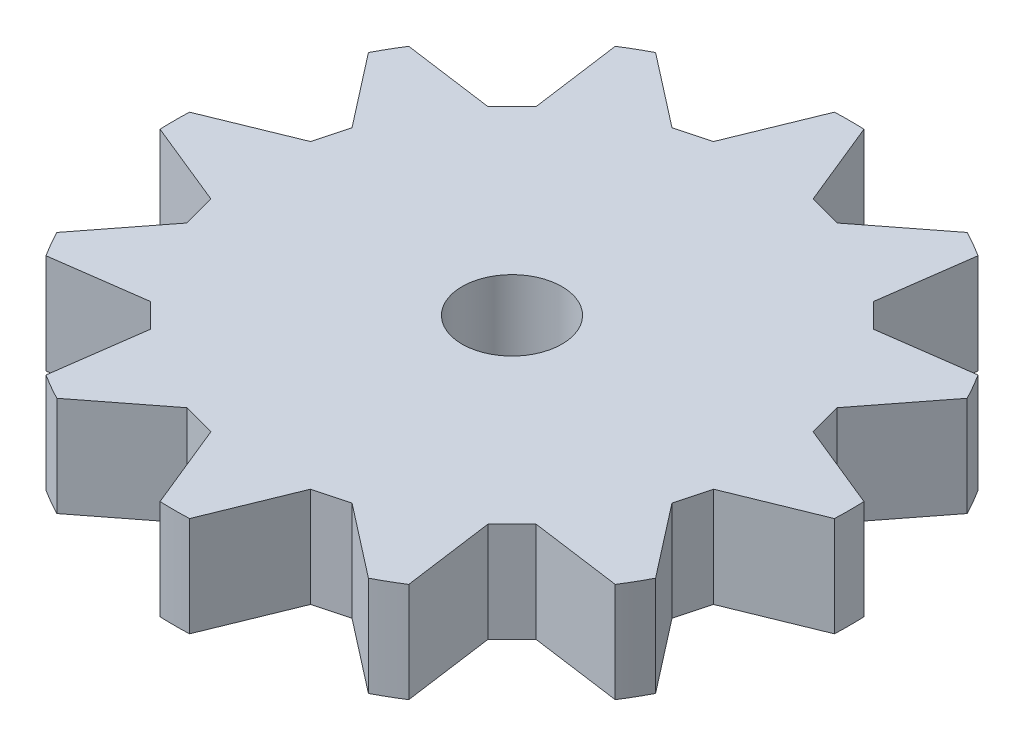
from build123d import *

# Parameters (mm, degrees)
SKETCH1_R           = 15
SKETCH1_R_2         = 2.5
BOSS_EXTRUDE1_DEPTH = 5
BOSS_EXTRUDE2_START = -5
SKETCH2_R           = 17
SKETCH2_R_2         = 15
BOSS_EXTRUDE2_DEPTH = 5
SKETCH3_R           = 18
CUT_EXTRUDE1_DEPTH  = 5
SKETCH4_R           = 18.354217927
CUT_EXTRUDE2_DEPTH  = 5


with BuildPart() as part:
    # Sketch1 → Boss-Extrude1 (new body)
    with BuildSketch(Plane(origin=(0, 0, 0), x_dir=(1, 0, 0), z_dir=(0, 1, 0))):
        with Locations(Location((0, 0, 0), (0, 0, 270))):
            Circle(SKETCH1_R)
        with Locations(Location((0, 0, 0), (0, 0, 270))):
            Circle(SKETCH1_R_2, mode=Mode.SUBTRACT)
    extrude(amount=BOSS_EXTRUDE1_DEPTH)

    # Sketch2 → Boss-Extrude2 (add)
    with BuildSketch(Plane(origin=(0, 5, 0), x_dir=(1, 0, 0), z_dir=(0, 1, 0)).offset(BOSS_EXTRUDE2_START)):
        with Locations(Location((0, 0, 0), (0, 0, 270))):
            Circle(SKETCH2_R)
        Circle(SKETCH2_R_2, mode=Mode.SUBTRACT)
    extrude(amount=BOSS_EXTRUDE2_DEPTH)

    # Sketch3 → Cut-Extrude1 (cut)
    with BuildSketch(Plane(origin=(0, 5, 0), x_dir=(1, 0, 0), z_dir=(0, 1, 0))):
        Circle(SKETCH3_R)
        Polygon((0.800081407, 17), (-0.800081407, 17), (-2.565946388, 12.667519465), (-3.338765682, 12.460443159), (-4.111584976, 12.253366853), (-7.807109176, 15.122472568), (-9.192890824, 14.322391161), (-8.555934489, 9.687420466), (-9.121677477, 9.121677477), (-9.687420466, 8.555934489), (-14.322391161, 9.192890824), (-15.122472568, 7.807109176), (-12.253366853, 4.111584976), (-12.460443159, 3.338765682), (-12.667519465, 2.565946388), (-17, 0.800081407), (-17, -0.800081407), (-12.667519465, -2.565946388), (-12.460443159, -3.338765682), (-12.253366853, -4.111584976), (-15.122472568, -7.807109176), (-14.322391161, -9.192890824), (-9.687420466, -8.555934489), (-9.121677477, -9.121677477), (-8.555934489, -9.687420466), (-9.192890824, -14.322391161), (-7.807109176, -15.122472568), (-4.111584976, -12.253366853), (-3.338765682, -12.460443159), (-2.565946388, -12.667519465), (-0.800081407, -17), (0.800081407, -17), (2.565946388, -12.667519465), (3.338765682, -12.460443159), (4.111584976, -12.253366853), (7.807109176, -15.122472568), (9.192890824, -14.322391161), (8.555934489, -9.687420466), (9.121677477, -9.121677477), (9.687420466, -8.555934489), (14.322391161, -9.192890824), (15.122472568, -7.807109176), (12.253366853, -4.111584976), (12.460443159, -3.338765682), (12.667519465, -2.565946388), (17, -0.800081407), (17, 0.800081407), (12.667519465, 2.565946388), (12.460443159, 3.338765682), (12.253366853, 4.111584976), (15.122472568, 7.807109176), (14.322391161, 9.192890824), (9.687420466, 8.555934489), (9.121677477, 9.121677477), (8.555934489, 9.687420466), (9.192890824, 14.322391161), (7.807109176, 15.122472568), (4.111584976, 12.253366853), (3.338765682, 12.460443159), (2.565946388, 12.667519465), align=None, mode=Mode.SUBTRACT)
    extrude(amount=-CUT_EXTRUDE1_DEPTH, mode=Mode.SUBTRACT)

    # Sketch4 → Cut-Extrude2 (cut)
    with BuildSketch(Plane(origin=(0, 5, 0), x_dir=(1, 0, 0), z_dir=(0, 1, 0))):
        Circle(SKETCH4_R)
        with BuildLine():
            Line((2.492089445, 12.583781755), (4.133678109, 12.143919398))
            Line((4.133678109, 12.143919398), (7.801525521, 14.991537598))
            ThreePointArc((7.801525521, 14.991537598), (8.45, 14.635829324), (9.082289641, 14.252088088))
            Line((9.082289641, 14.252088088), (8.450103646, 9.651829953))
            Line((8.450103646, 9.651829953), (9.651829953, 8.450103646))
            Line((9.651829953, 8.450103646), (14.252088088, 9.082289641))
            ThreePointArc((14.252088088, 9.082289641), (14.635829324, 8.45), (14.991537598, 7.801525521))
            Line((14.991537598, 7.801525521), (12.143919398, 4.133678109))
            Line((12.143919398, 4.133678109), (12.583781755, 2.492089445))
            Line((12.583781755, 2.492089445), (16.883815162, 0.739449509))
            ThreePointArc((16.883815162, 0.739449509), (16.9, 0), (16.883815162, -0.739449509))
            Line((16.883815162, -0.739449509), (12.583781755, -2.492089445))
            Line((12.583781755, -2.492089445), (12.143919398, -4.133678109))
            Line((12.143919398, -4.133678109), (14.991537598, -7.801525521))
            ThreePointArc((14.991537598, -7.801525521), (14.635829324, -8.45), (14.252088088, -9.082289641))
            Line((14.252088088, -9.082289641), (9.651829953, -8.450103646))
            Line((9.651829953, -8.450103646), (8.450103646, -9.651829953))
            Line((8.450103646, -9.651829953), (9.082289641, -14.252088088))
            ThreePointArc((9.082289641, -14.252088088), (8.45, -14.635829324), (7.801525521, -14.991537598))
            Line((7.801525521, -14.991537598), (4.133678109, -12.143919398))
            Line((4.133678109, -12.143919398), (2.492089445, -12.583781755))
            Line((2.492089445, -12.583781755), (0.739449509, -16.883815162))
            ThreePointArc((0.739449509, -16.883815162), (0, -16.9), (-0.739449509, -16.883815162))
            Line((-0.739449509, -16.883815162), (-2.492089445, -12.583781755))
            Line((-2.492089445, -12.583781755), (-4.133678109, -12.143919398))
            Line((-4.133678109, -12.143919398), (-7.801525521, -14.991537598))
            ThreePointArc((-7.801525521, -14.991537598), (-8.45, -14.635829324), (-9.082289641, -14.252088088))
            Line((-9.082289641, -14.252088088), (-8.450103646, -9.651829953))
            Line((-8.450103646, -9.651829953), (-9.651829953, -8.450103646))
            Line((-9.651829953, -8.450103646), (-14.252088088, -9.082289641))
            ThreePointArc((-14.252088088, -9.082289641), (-14.635829324, -8.45), (-14.991537598, -7.801525521))
            Line((-14.991537598, -7.801525521), (-12.143919398, -4.133678109))
            Line((-12.143919398, -4.133678109), (-12.583781755, -2.492089445))
            Line((-12.583781755, -2.492089445), (-16.883815162, -0.739449509))
            ThreePointArc((-16.883815162, -0.739449509), (-16.9, 0), (-16.883815162, 0.739449509))
            Line((-16.883815162, 0.739449509), (-12.583781755, 2.492089445))
            Line((-12.583781755, 2.492089445), (-12.143919398, 4.133678109))
            Line((-12.143919398, 4.133678109), (-14.991537598, 7.801525521))
            ThreePointArc((-14.991537598, 7.801525521), (-14.635829324, 8.45), (-14.252088088, 9.082289641))
            Line((-14.252088088, 9.082289641), (-9.651829953, 8.450103646))
            Line((-9.651829953, 8.450103646), (-8.450103646, 9.651829953))
            Line((-8.450103646, 9.651829953), (-9.082289641, 14.252088088))
            ThreePointArc((-9.082289641, 14.252088088), (-8.45, 14.635829324), (-7.801525521, 14.991537598))
            Line((-7.801525521, 14.991537598), (-4.133678109, 12.143919398))
            Line((-4.133678109, 12.143919398), (-2.492089445, 12.583781755))
            Line((-2.492089445, 12.583781755), (-0.739449509, 16.883815162))
            ThreePointArc((-0.739449509, 16.883815162), (0, 16.9), (0.739449509, 16.883815162))
            Line((0.739449509, 16.883815162), (2.492089445, 12.583781755))
        make_face(mode=Mode.SUBTRACT)
    extrude(amount=-CUT_EXTRUDE2_DEPTH, mode=Mode.SUBTRACT)


solid = part.part
